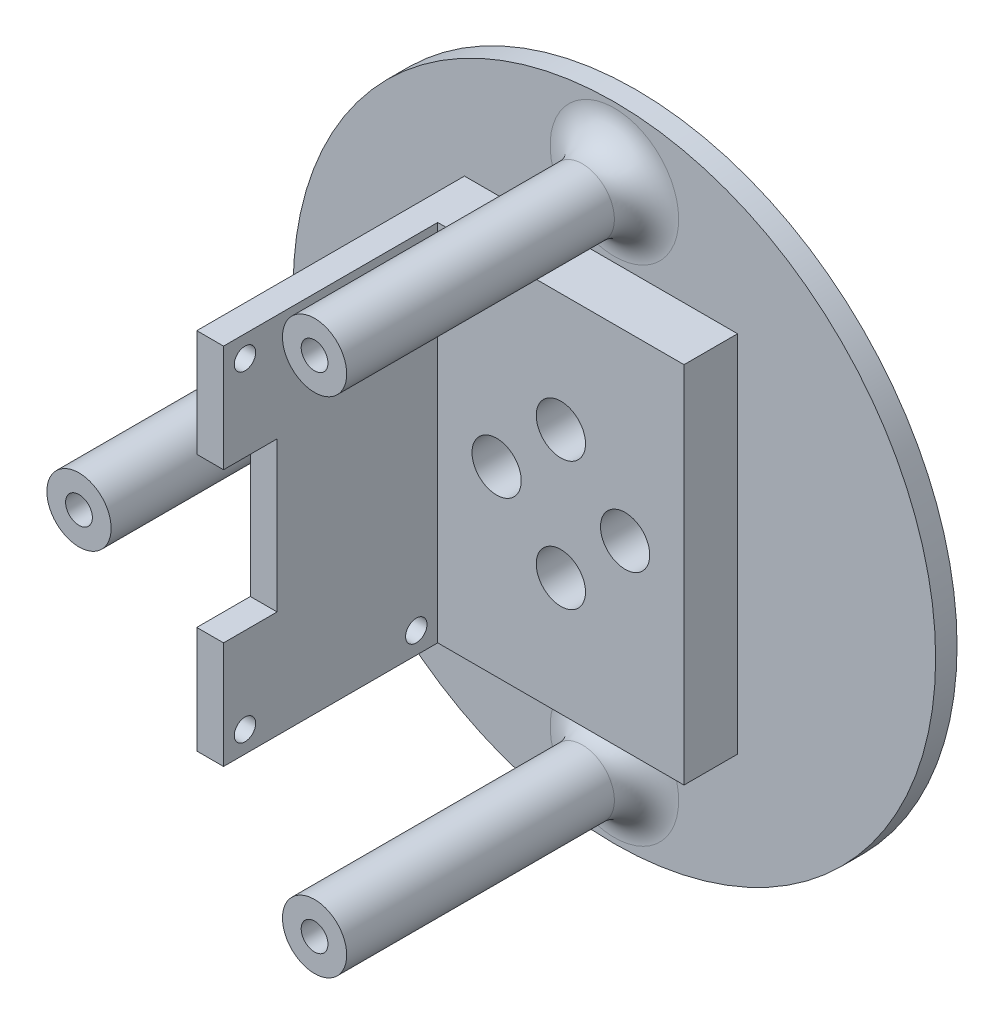
from build123d import *

# Parameters (mm, degrees)
CROQUIS1_R              = 19.85
SALIENTE_EXTRUIR1_DEPTH = 6
CROQUIS2_R              = 30
SALIENTE_EXTRUIR3_DEPTH = 2
CROQUIS3_W              = 2.5
CROQUIS3_H              = 34
SALIENTE_EXTRUIR4_DEPTH = 20
CROQUIS4_W              = 2.5
CROQUIS4_H              = 10
SALIENTE_EXTRUIR5_DEPTH = 5
CROQUIS5_W              = 23
CROQUIS5_H              = 34
SALIENTE_EXTRUIR6_DEPTH = 5
CORTAR_EXTRUIR1_REACH   = 64.65
CROQUIS6_R              = 1
CORTAR_EXTRUIR3_REACH   = 55.749
CROQUIS8_R              = 1
CROQUIS10_R             = 3
CROQUIS10_R_2           = 1.25
SALIENTE_EXTRUIR8_DEPTH = 28
REDONDEO1_R             = 3
CROQUIS11_R             = 4.5
CORTAR_EXTRUIR5_DEPTH   = 10
REDONDEO2_R             = 1
CROQUIS12_R             = 2.3
CORTAR_EXTRUIR6_DEPTH   = 11


with BuildPart() as part:
    # Croquis1 → Saliente-Extruir1 (new body)
    with BuildSketch(Plane.XY):
        Circle(CROQUIS1_R)
    extrude(amount=SALIENTE_EXTRUIR1_DEPTH)

    # Croquis2 → Saliente-Extruir3 (add)
    with BuildSketch(Plane.XY.offset(6)):
        Circle(CROQUIS2_R)
    extrude(amount=SALIENTE_EXTRUIR3_DEPTH)

    # Croquis3 → Saliente-Extruir4 (add)
    with BuildSketch(Plane.XY.offset(8)):
        with Locations((-12.75, 0)):
            Rectangle(CROQUIS3_W, CROQUIS3_H)
    extrude(amount=SALIENTE_EXTRUIR4_DEPTH)

    # Croquis4 → Saliente-Extruir5 (add)
    with BuildSketch(Plane.XY.offset(28)):
        with Locations((-12.75, 12)):
            Rectangle(CROQUIS4_W, CROQUIS4_H)
        with Locations((-12.75, -12)):
            Rectangle(CROQUIS4_W, CROQUIS4_H)
    extrude(amount=SALIENTE_EXTRUIR5_DEPTH)

    # Croquis5 → Saliente-Extruir6 (add)
    with BuildSketch(Plane.XY.offset(8)):
        Rectangle(CROQUIS5_W, CROQUIS5_H)
    extrude(amount=SALIENTE_EXTRUIR6_DEPTH)

    # Croquis6 → Cortar-Extruir1 (cut, up to next)
    with BuildSketch(Plane.ZY.offset(14), mode=Mode.PRIVATE) as cortar_extruir1_sk1:
        with Locations((15, -15)):
            Circle(CROQUIS6_R)
    cortar_extruir1_tool1 = extrude(cortar_extruir1_sk1.sketch, amount=-CORTAR_EXTRUIR1_REACH, mode=Mode.PRIVATE) & part.part
    # Croquis6 → Cortar-Extruir1 (cut, up to next)
    with BuildSketch(Plane.ZY.offset(14), mode=Mode.PRIVATE) as cortar_extruir1_sk2:
        with Locations((31, -15)):
            Circle(CROQUIS6_R)
    cortar_extruir1_tool2 = extrude(cortar_extruir1_sk2.sketch, amount=-CORTAR_EXTRUIR1_REACH, mode=Mode.PRIVATE) & part.part
    # Croquis6 → Cortar-Extruir1 (cut, up to next)
    with BuildSketch(Plane.ZY.offset(14), mode=Mode.PRIVATE) as cortar_extruir1_sk3:
        with Locations((15, 15)):
            Circle(CROQUIS6_R)
    cortar_extruir1_tool3 = extrude(cortar_extruir1_sk3.sketch, amount=-CORTAR_EXTRUIR1_REACH, mode=Mode.PRIVATE) & part.part
    # Croquis6 → Cortar-Extruir1 (cut, up to next)
    with BuildSketch(Plane.ZY.offset(14), mode=Mode.PRIVATE) as cortar_extruir1_sk4:
        with Locations((31, 15)):
            Circle(CROQUIS6_R)
    cortar_extruir1_tool4 = extrude(cortar_extruir1_sk4.sketch, amount=-CORTAR_EXTRUIR1_REACH, mode=Mode.PRIVATE) & part.part
    add(cortar_extruir1_tool1.solids().sort_by_distance((-14, -15, 15))[0], mode=Mode.SUBTRACT)
    add(cortar_extruir1_tool2.solids().sort_by_distance((-14, -15, 31))[0], mode=Mode.SUBTRACT)
    add(cortar_extruir1_tool3.solids().sort_by_distance((-14, 15, 15))[0], mode=Mode.SUBTRACT)
    add(cortar_extruir1_tool4.solids().sort_by_distance((-14, 15, 31))[0], mode=Mode.SUBTRACT)

    # Croquis8 → Cortar-Extruir3 (cut, up to next)
    with BuildSketch(Plane(origin=(0, 0, 0), x_dir=(-1, 0, 0), z_dir=(0, 0, -1)), mode=Mode.PRIVATE) as cortar_extruir3_sk1:
        with Locations((0.001043545, -5.999999909)):
            Circle(CROQUIS8_R)
    cortar_extruir3_tool1 = extrude(cortar_extruir3_sk1.sketch, amount=-CORTAR_EXTRUIR3_REACH, mode=Mode.PRIVATE) & part.part
    # Croquis8 → Cortar-Extruir3 (cut, up to next)
    with BuildSketch(Plane(origin=(0, 0, 0), x_dir=(-1, 0, 0), z_dir=(0, 0, -1)), mode=Mode.PRIVATE) as cortar_extruir3_sk2:
        with Locations((-5.999999909, -0.001043545)):
            Circle(CROQUIS8_R)
    cortar_extruir3_tool2 = extrude(cortar_extruir3_sk2.sketch, amount=-CORTAR_EXTRUIR3_REACH, mode=Mode.PRIVATE) & part.part
    # Croquis8 → Cortar-Extruir3 (cut, up to next)
    with BuildSketch(Plane(origin=(0, 0, 0), x_dir=(-1, 0, 0), z_dir=(0, 0, -1)), mode=Mode.PRIVATE) as cortar_extruir3_sk3:
        with Locations((-0.001043545, 5.999999909)):
            Circle(CROQUIS8_R)
    cortar_extruir3_tool3 = extrude(cortar_extruir3_sk3.sketch, amount=-CORTAR_EXTRUIR3_REACH, mode=Mode.PRIVATE) & part.part
    # Croquis8 → Cortar-Extruir3 (cut, up to next)
    with BuildSketch(Plane(origin=(0, 0, 0), x_dir=(-1, 0, 0), z_dir=(0, 0, -1)), mode=Mode.PRIVATE) as cortar_extruir3_sk4:
        with Locations((5.999999909, 0.001043545)):
            Circle(CROQUIS8_R)
    cortar_extruir3_tool4 = extrude(cortar_extruir3_sk4.sketch, amount=-CORTAR_EXTRUIR3_REACH, mode=Mode.PRIVATE) & part.part
    add(cortar_extruir3_tool1.solids().sort_by_distance((-0.001044, -6, 0))[0], mode=Mode.SUBTRACT)
    add(cortar_extruir3_tool2.solids().sort_by_distance((6, -0.001044, 0))[0], mode=Mode.SUBTRACT)
    add(cortar_extruir3_tool3.solids().sort_by_distance((0.001044, 6, 0))[0], mode=Mode.SUBTRACT)
    add(cortar_extruir3_tool4.solids().sort_by_distance((-6, 0.001044, 0))[0], mode=Mode.SUBTRACT)

    # Croquis10 → Saliente-Extruir8 (add)
    # profile 1 of 3: a face of its own
    with BuildSketch(Plane.XY.offset(8)):
        with Locations((0, 23.5)):
            Circle(CROQUIS10_R)
        with Locations((0, 23.5)):
            Circle(CROQUIS10_R_2, mode=Mode.SUBTRACT)
    # profile 2 of 3: a face of its own
    with BuildSketch(Plane.XY.offset(8)):
        with Locations((0, -23.5)):
            Circle(CROQUIS10_R)
        with Locations((0, -23.5)):
            Circle(CROQUIS10_R_2, mode=Mode.SUBTRACT)
    # profile 3 of 3: a face of its own
    with BuildSketch(Plane.XY.offset(8)):
        with Locations((-22, 0)):
            Circle(CROQUIS10_R)
        with Locations((-22, 0)):
            Circle(CROQUIS10_R_2, mode=Mode.SUBTRACT)
    extrude(amount=SALIENTE_EXTRUIR8_DEPTH)

    # Redondeo1
    redondeo1_edges = [part.edges().sort_by_distance(p)[0] for p in [
        (-3, 23.5, 8),
        (-3, -23.5, 8),
        (-25, 0, 8),
    ]]
    fillet(redondeo1_edges, radius=REDONDEO1_R)

    # Croquis11 → Cortar-Extruir5 (cut)
    with BuildSketch(Plane(origin=(0, 0, 0), x_dir=(-1, 0, 0), z_dir=(0, 0, -1))):
        with Locations((13.999999486, 0.002434939)):
            Circle(CROQUIS11_R)
    extrude(amount=-CORTAR_EXTRUIR5_DEPTH, mode=Mode.SUBTRACT)

    # Redondeo2
    redondeo2_edges = [part.edges().sort_by_distance(p)[0] for p in [
        (-14, 0.002434939, 10),
        (-14, -4.497565061, 9),
        (-14, 4.502434939, 9),
    ]]
    fillet(redondeo2_edges, radius=REDONDEO2_R)

    # Croquis12 → Cortar-Extruir6 (cut)
    with BuildSketch(Plane.XY.offset(13)):
        with Locations((5.999999909, -0.001043545)):
            Circle(CROQUIS12_R)
        with Locations((-0.001043545, -5.999999909)):
            Circle(CROQUIS12_R)
        with Locations((-5.999999909, 0.001043545)):
            Circle(CROQUIS12_R)
        with Locations((0.001043545, 5.999999909)):
            Circle(CROQUIS12_R)
    extrude(amount=-CORTAR_EXTRUIR6_DEPTH, mode=Mode.SUBTRACT)


solid = part.part
